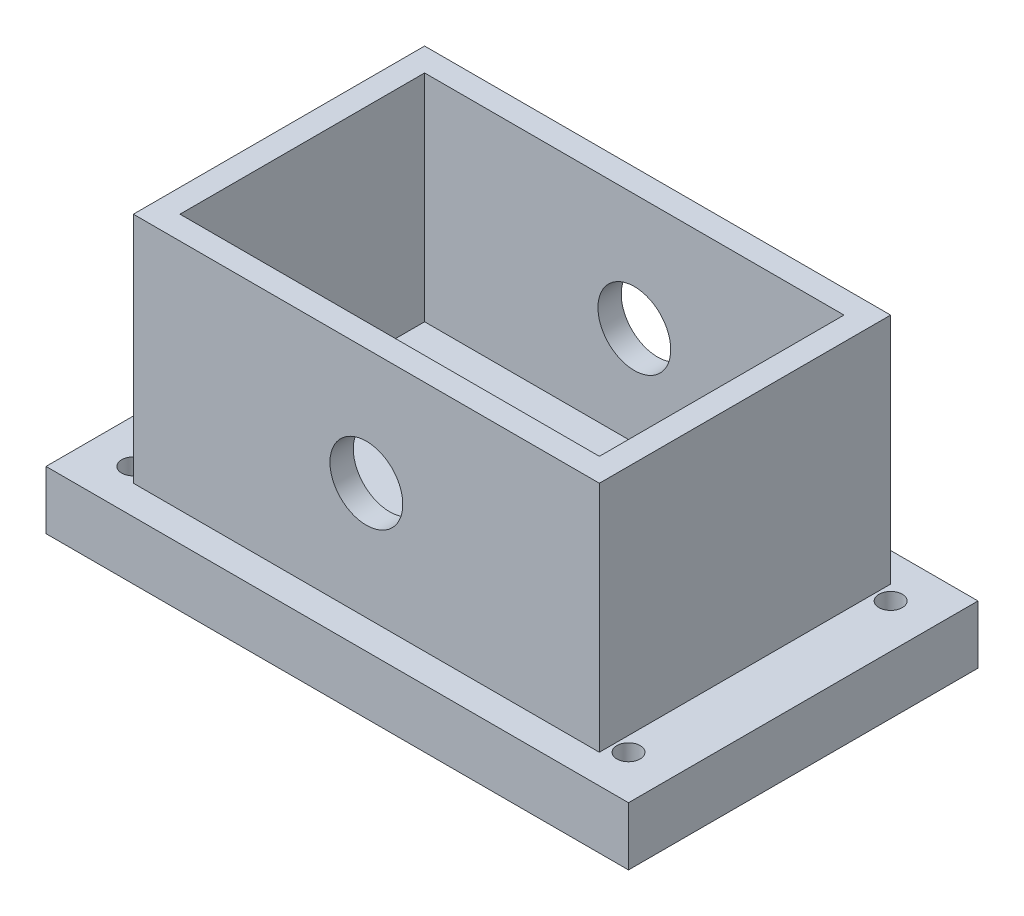
from build123d import *

# Parameters (mm, degrees)
SKETCH_1_W          = 200
SKETCH_1_H          = 120
EXTRUDE_1_DEPTH     = 20
SKETCH_2_W          = 160
SKETCH_2_H          = 100
EXTRUDE_2_DEPTH     = 80
SKETCH_3_W          = 144
SKETCH_3_H          = 84
CUT_EXTRUDE_1_DEPTH = 139.115893365
SKETCH_4_R          = 4
CUT_EXTRUDE_2_DEPTH = 154.622914957
SKETCH_5_R          = 12.5
CUT_EXTRUDE_3_DEPTH = 201


with BuildPart() as part:
    # 草图1 → 凸台-拉伸1 (new body)
    with BuildSketch(Plane(origin=(0, 0, 0), x_dir=(1, 0, 0), z_dir=(0, 1, 0))):
        Rectangle(SKETCH_1_W, SKETCH_1_H)
    extrude(amount=EXTRUDE_1_DEPTH)

    # 草图2 → 凸台-拉伸2 (add)
    with BuildSketch(Plane(origin=(0, 20, 0), x_dir=(1, 0, 0), z_dir=(0, 1, 0))):
        Rectangle(SKETCH_2_W, SKETCH_2_H)
    extrude(amount=EXTRUDE_2_DEPTH)

    # 草图3 → 切除-拉伸1 (cut, through all)
    with BuildSketch(Plane(origin=(0, 26, 0), x_dir=(1, 0, 0), z_dir=(0, 1, 0))):
        Rectangle(SKETCH_3_W, SKETCH_3_H)
    extrude(amount=CUT_EXTRUDE_1_DEPTH, mode=Mode.SUBTRACT)

    # 草图4 → 切除-拉伸2 (cut, through all)
    with BuildSketch(Plane(origin=(0, 0, 0), x_dir=(1, 0, 0), z_dir=(0, 1, 0))):
        with Locations(Location((85, -45, 0), (0, 0, 90))):
            Circle(SKETCH_4_R)
        with Locations(Location((85, 45, 0), (0, 0, 90))):
            Circle(SKETCH_4_R)
        with Locations(Location((-85, -45, 0), (0, 0, 90))):
            Circle(SKETCH_4_R)
        with Locations(Location((-85, 45, 0), (0, 0, 90))):
            Circle(SKETCH_4_R)
    extrude(amount=CUT_EXTRUDE_2_DEPTH, mode=Mode.SUBTRACT)

    # 草图5 → 切除-拉伸3 (cut, symmetric)
    with BuildSketch(Plane.XY):
        with Locations((0, 60)):
            Circle(SKETCH_5_R)
    extrude(amount=CUT_EXTRUDE_3_DEPTH, both=True, mode=Mode.SUBTRACT)


solid = part.part
